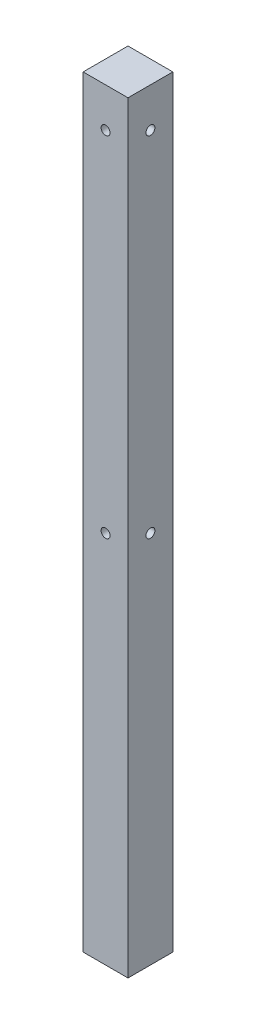
from build123d import *

# Parameters (mm, degrees)
ESBO_O1_W                = 100
ESBO_O1_H                = 100
RESSALTO_EXTRUS_O1_DEPTH = 1700
FUROS_GUIA_COM_20_0MM1_D = 20
FUROS_GUIA_COM_20_0MM2_D = 20


with BuildPart() as part:
    # Esboço1 → Ressalto-extrusão1 (new body)
    with BuildSketch(Plane(origin=(0, 0, 0), x_dir=(1, 0, 0), z_dir=(0, 1, 0))):
        Rectangle(ESBO_O1_W, ESBO_O1_H)
    extrude(amount=RESSALTO_EXTRUS_O1_DEPTH)

    # Furos-guia com Ø20.0mm1 (through all)
    with Locations(Plane(origin=(50, 0, 0), x_dir=(0, 0, -1), z_dir=(1, 0, 0))):
        with Locations((0, 834.25), (0, 1612.275483602)):
            Hole(FUROS_GUIA_COM_20_0MM1_D / 2)

    # Furos-guia com Ø20.0mm2 (through all)
    with Locations(Plane.XY.offset(50)):
        with Locations((0, 834.25), (0, 1612.28)):
            Hole(FUROS_GUIA_COM_20_0MM2_D / 2)


solid = part.part
